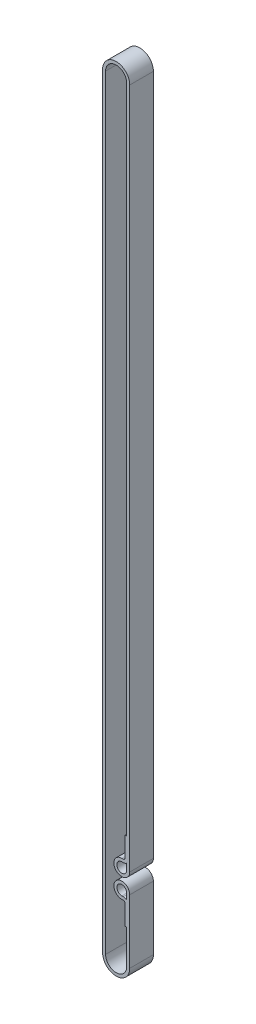
from build123d import *

# Parameters (mm, degrees)
EXTRUDE_THIN1_DEPTH = 12
BOSS_EXTRUDE2_START = -12
BOSS_EXTRUDE2_DEPTH = 12


with BuildPart() as part:
    # Sketch1 → Extrude-Thin1 (new body)
    with BuildSketch(Plane.XY):
        with BuildLine():
            Line((5.107, -330.696), (5.107, -340.696))
            ThreePointArc((5.107, -340.696), (4.667660172, -341.756660172), (3.607, -342.196))
            Line((3.607, -342.196), (2.861, -342.196))
            ThreePointArc((2.861, -342.196), (0.383297839, -348.177702161), (6.365, -345.7))
            Line((6.365, -345.7), (6.365, 0))
            ThreePointArc((6.365, 0), (0, 6.365), (-6.365, 0))
            Line((-6.365, 0), (-6.365, -388))
            ThreePointArc((-6.365, -388), (0, -394.365), (6.365, -388))
            Line((6.365, -388), (6.365, -355.7))
            ThreePointArc((6.365, -355.7), (0.383297839, -353.222297839), (2.861, -359.204))
            Line((2.861, -359.204), (3.607, -359.204))
            ThreePointArc((3.607, -359.204), (4.667660172, -359.643339828), (5.107, -360.704))
            Line((5.107, -360.704), (5.107, -370.704))
            Line((5.107, -370.704), (4.591, -370.704))
            Line((4.591, -370.704), (4.591, -360.704))
            ThreePointArc((4.591, -360.704), (4.302793073, -360.008206927), (3.607, -359.72))
            Line((3.607, -359.72), (2.861, -359.72))
            ThreePointArc((2.861, -359.72), (0.01843074, -352.85743074), (6.881, -355.7))
            Line((6.881, -355.7), (6.881, -388))
            ThreePointArc((6.881, -388), (0, -394.881), (-6.881, -388))
            Line((-6.881, -388), (-6.881, 0))
            ThreePointArc((-6.881, 0), (0, 6.881), (6.881, 0))
            Line((6.881, 0), (6.881, -345.7))
            ThreePointArc((6.881, -345.7), (0.01843074, -348.54256926), (2.861, -341.68))
            Line((2.861, -341.68), (3.607, -341.68))
            ThreePointArc((3.607, -341.68), (4.302793073, -341.391793073), (4.591, -340.696))
            Line((4.591, -340.696), (4.591, -330.696))
            Line((4.591, -330.696), (5.107, -330.696))
        make_face()
    extrude(amount=EXTRUDE_THIN1_DEPTH)

    # Sketch3 → Boss-Extrude2 (add)
    with BuildSketch(Plane.XY.offset(12).offset(BOSS_EXTRUDE2_START)):
        with BuildLine():
            ThreePointArc((-5.361, -388), (0, -393.361), (5.361, -388))
            Line((5.361, -388), (5.361, -370.704))
            Line((5.361, -370.704), (5.107, -370.704))
            Line((5.107, -370.704), (5.107, -360.704))
            ThreePointArc((5.107, -360.704), (4.667660172, -359.643339828), (3.607, -359.204))
            Line((3.607, -359.204), (2.861, -359.204))
            ThreePointArc((2.861, -359.204), (0.383297839, -353.222297839), (6.365, -355.7))
            Line((6.365, -355.7), (6.365, -388))
            ThreePointArc((6.365, -388), (0, -394.365), (-6.365, -388))
            Line((-6.365, -388), (-6.365, 0))
            ThreePointArc((-6.365, 0), (0, 6.365), (6.365, 0))
            Line((6.365, 0), (6.365, -345.7))
            ThreePointArc((6.365, -345.7), (0.383297839, -348.177702161), (2.861, -342.196))
            Line((2.861, -342.196), (3.607, -342.196))
            ThreePointArc((3.607, -342.196), (4.667660172, -341.756660172), (5.107, -340.696))
            Line((5.107, -340.696), (5.107, -330.696))
            Line((5.107, -330.696), (5.361, -330.696))
            Line((5.361, -330.696), (5.361, 0))
            ThreePointArc((5.361, 0), (0, 5.361), (-5.361, 0))
            Line((-5.361, 0), (-5.361, -388))
        make_face()
        with BuildLine():
            ThreePointArc((5.361, -355.7), (1.093233047, -353.932233047), (2.861, -358.2))
            Line((2.861, -358.2), (3.607, -358.2))
            ThreePointArc((3.607, -358.2), (4.554437655, -358.386160944), (5.361, -358.916963347))
            Line((5.361, -358.916963347), (5.361, -355.7))
        make_face(mode=Mode.SUBTRACT)
        with BuildLine():
            ThreePointArc((2.861, -343.2), (1.093233047, -347.467766953), (5.361, -345.7))
            Line((5.361, -345.7), (5.361, -342.483036653))
            ThreePointArc((5.361, -342.483036653), (4.554437655, -343.013839056), (3.607, -343.2))
            Line((3.607, -343.2), (2.861, -343.2))
        make_face(mode=Mode.SUBTRACT)
    extrude(amount=BOSS_EXTRUDE2_DEPTH)


solid = part.part
